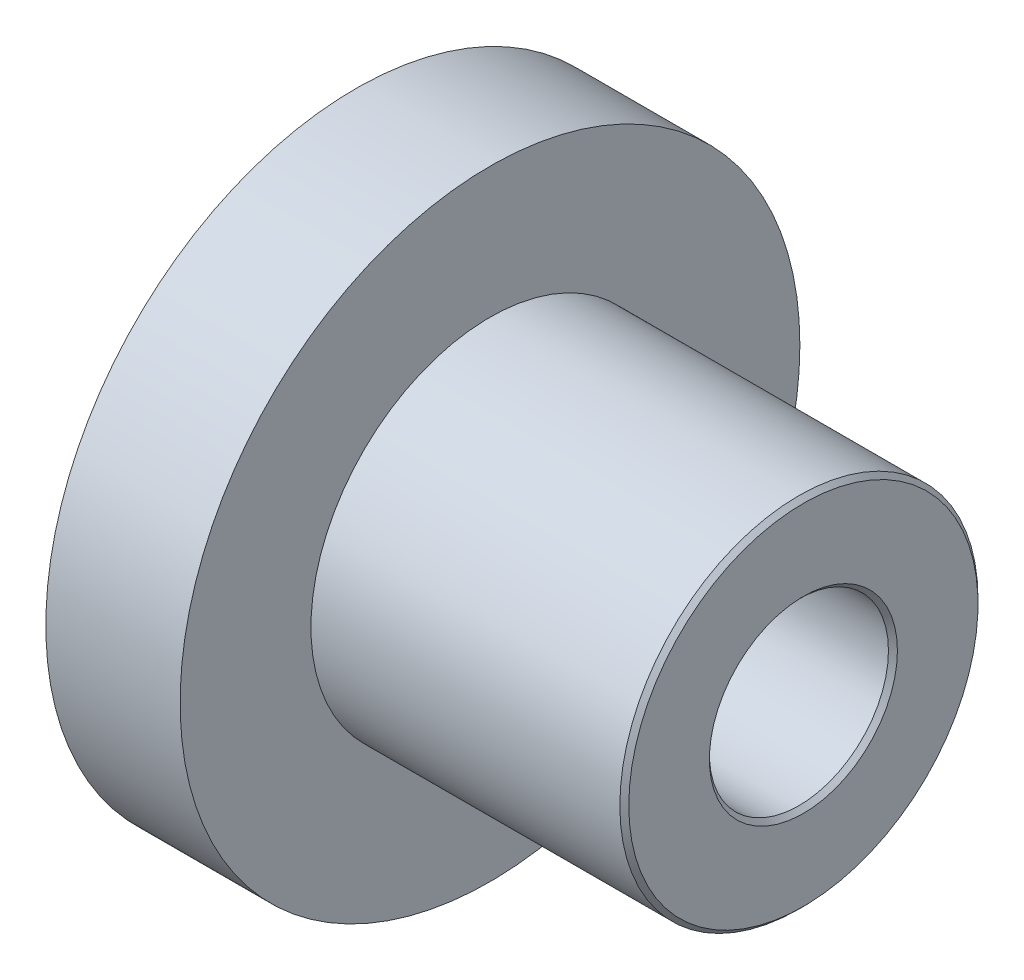
from build123d import *

# Parameters (mm, degrees)
SKETCH1_R                = 6.9215
BOSS_EXTRUDE1_DEPTH      = 3
SKETCH3_W                = 7
SKETCH3_H                = 4
F_4_0_4_DIAMETER_HOLE1_D = 4
CHAMFER1_SIZE            = 0.1


with BuildPart() as part:
    # Sketch1 → Boss-Extrude1 (new body)
    with BuildSketch(Plane(origin=(1.5, 0, 0), x_dir=(0, 0, -1), z_dir=(1, 0, 0))):
        Circle(SKETCH1_R)
    extrude(amount=-BOSS_EXTRUDE1_DEPTH)

    # Sketch3 → Revolve1 (revolve)
    with BuildSketch(Plane.XY, mode=Mode.PRIVATE) as revolve1_sk:
        with Locations((5, 2)):
            Rectangle(SKETCH3_W, SKETCH3_H)
    revolve(revolve1_sk.sketch.rotate(Axis((1.5, 0, 0), (1, 0, 0)), 270), axis=Axis((1.5, 0, 0), (1, 0, 0)))

    # Ø4.0 (4) Diameter Hole1 (through all)
    with Locations(Plane.ZY.offset(1.5)):
        with Locations((0, 0)):
            Hole(F_4_0_4_DIAMETER_HOLE1_D / 2)

    # Chamfer1
    chamfer1_edges = [part.edges().sort_by_distance(p)[0] for p in [
        (-1.5, 0, 2),
        (8.5, 0, 2),
        (8.5, 0, 4),
    ]]
    chamfer(chamfer1_edges, length=CHAMFER1_SIZE)


solid = part.part
